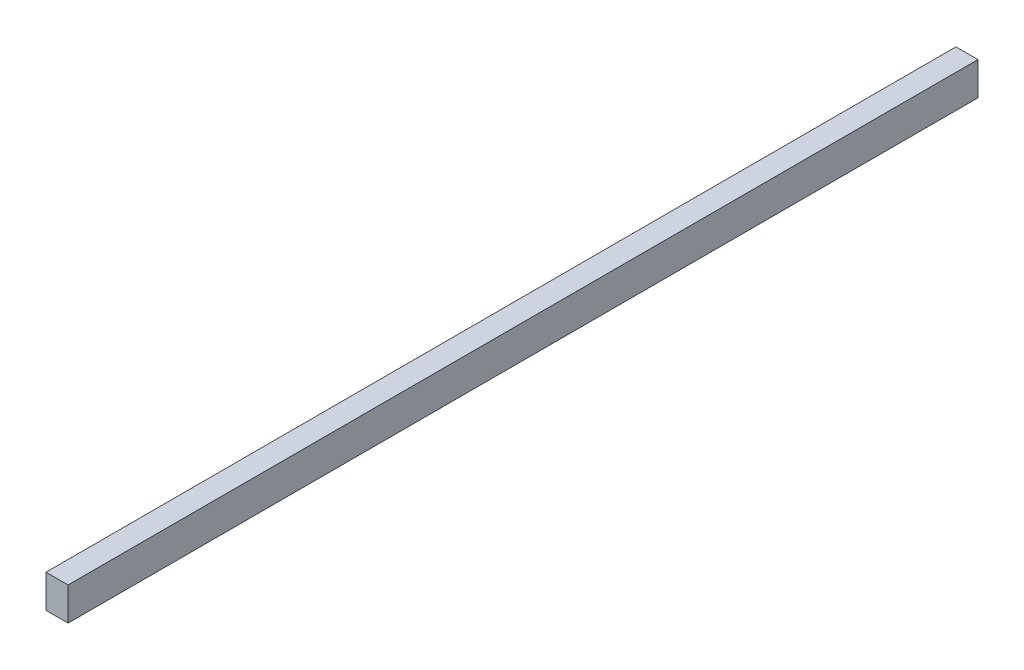
from build123d import *

# Parameters (mm, degrees)
SKETCH1_W           = 495
SKETCH1_H           = 18
BOSS_EXTRUDE1_DEPTH = 12


with BuildPart() as part:
    # Sketch1 → Boss-Extrude1 (new body)
    with BuildSketch(Plane(origin=(0, 0, 0), x_dir=(0, 0, -1), z_dir=(1, 0, 0))):
        with Locations((247.5, 9)):
            Rectangle(SKETCH1_W, SKETCH1_H)
    extrude(amount=BOSS_EXTRUDE1_DEPTH)


solid = part.part
